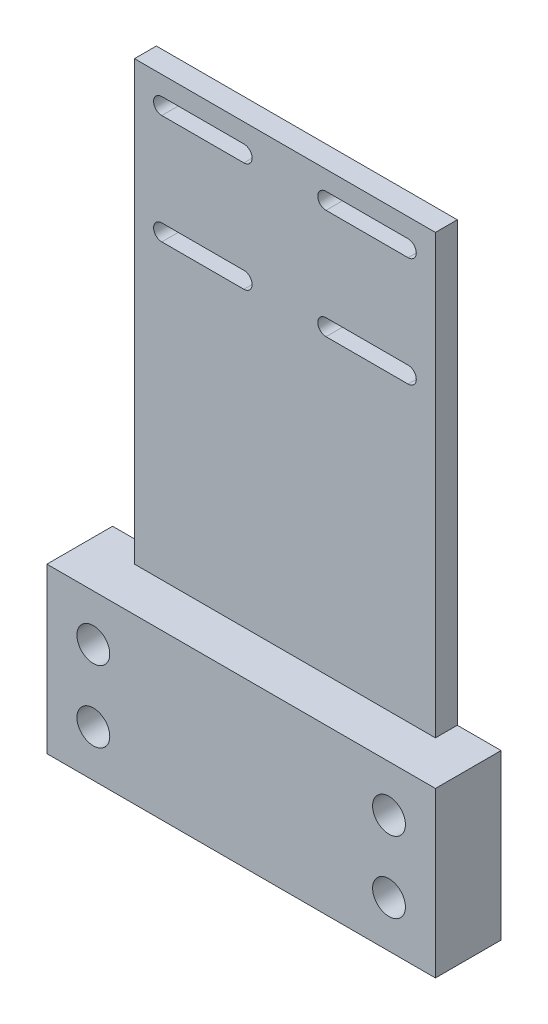
from build123d import *

# Parameters (mm, degrees)
SKETCH1_W           = 55
SKETCH1_H           = 30
BOSS_EXTRUDE1_DEPTH = 4
SKETCH4_W           = 55
SKETCH4_H           = 4
BOSS_EXTRUDE2_DEPTH = 80
SKETCH5_W           = 4
SKETCH5_H           = 30
BOSS_EXTRUDE3_DEPTH = 8
SKETCH6_W           = 4
SKETCH6_H           = 30
BOSS_EXTRUDE4_DEPTH = 8
SKETCH7_W           = 71
SKETCH7_H           = 30
BOSS_EXTRUDE5_DEPTH = 8
SKETCH9_R           = 3
CUT_EXTRUDE1_DEPTH  = 8
SKETCH8_R           = 5
CUT_EXTRUDE4_DEPTH  = 4


with BuildPart() as part:
    # Sketch1 → Boss-Extrude1 (new body)
    with BuildSketch(Plane.XY):
        with Locations((0, 20)):
            Rectangle(SKETCH1_W, SKETCH1_H)
        with BuildLine():
            Line((22.5, 31.5), (7.5, 31.5))
            ThreePointArc((7.5, 31.5), (6, 30), (7.5, 28.5))
            Line((7.5, 28.5), (22.5, 28.5))
            ThreePointArc((22.5, 28.5), (24, 30), (22.5, 31.5))
        make_face(mode=Mode.SUBTRACT)
        with BuildLine():
            Line((22.5, 8.5), (7.5, 8.5))
            ThreePointArc((7.5, 8.5), (6, 10), (7.5, 11.5))
            Line((7.5, 11.5), (22.5, 11.5))
            ThreePointArc((22.5, 11.5), (24, 10), (22.5, 8.5))
        make_face(mode=Mode.SUBTRACT)
        with BuildLine():
            Line((-22.5, 8.5), (-7.5, 8.5))
            ThreePointArc((-7.5, 8.5), (-6, 10), (-7.5, 11.5))
            Line((-7.5, 11.5), (-22.5, 11.5))
            ThreePointArc((-22.5, 11.5), (-24, 10), (-22.5, 8.5))
        make_face(mode=Mode.SUBTRACT)
        with BuildLine():
            Line((-7.5, 28.5), (-22.5, 28.5))
            ThreePointArc((-22.5, 28.5), (-24, 30), (-22.5, 31.5))
            Line((-22.5, 31.5), (-7.5, 31.5))
            ThreePointArc((-7.5, 31.5), (-6, 30), (-7.5, 28.5))
        make_face(mode=Mode.SUBTRACT)
    extrude(amount=BOSS_EXTRUDE1_DEPTH)

    # Sketch4 → Boss-Extrude2 (add)
    with BuildSketch(Plane.XZ.offset(-5)):
        with Locations((0, 2)):
            Rectangle(SKETCH4_W, SKETCH4_H)
    extrude(amount=BOSS_EXTRUDE2_DEPTH)

    # Sketch5 → Boss-Extrude3 (add)
    with BuildSketch(Plane.ZY.offset(27.5)):
        with Locations((2, -60)):
            Rectangle(SKETCH5_W, SKETCH5_H)
    extrude(amount=BOSS_EXTRUDE3_DEPTH)

    # Sketch6 → Boss-Extrude4 (add)
    with BuildSketch(Plane(origin=(27.5, 0, 0), x_dir=(0, 0, -1), z_dir=(1, 0, 0))):
        with Locations((-2, -60)):
            Rectangle(SKETCH6_W, SKETCH6_H)
    extrude(amount=BOSS_EXTRUDE4_DEPTH)

    # Sketch7 → Boss-Extrude5 (add)
    with BuildSketch(Plane.XY.offset(4)):
        with Locations((0, -60)):
            Rectangle(SKETCH7_W, SKETCH7_H)
    extrude(amount=BOSS_EXTRUDE5_DEPTH)

    # Sketch9 → Cut-Extrude1 (cut)
    with BuildSketch(Plane.XY.offset(12)):
        with Locations((27.014718626, -66.514718626)):
            Circle(SKETCH9_R)
        with Locations((27.014718626, -53.485281374)):
            Circle(SKETCH9_R)
        with Locations((-27.014718626, -53.485281374)):
            Circle(SKETCH9_R)
        with Locations((-27.014718626, -66.514718626)):
            Circle(SKETCH9_R)
    extrude(amount=-CUT_EXTRUDE1_DEPTH, mode=Mode.SUBTRACT)

    # Sketch8 → Cut-Extrude4 (cut)
    with BuildSketch(Plane(origin=(0, 0, 0), x_dir=(-1, 0, 0), z_dir=(0, 0, -1))):
        with Locations((-27.014718626, -53.485281374)):
            Circle(SKETCH8_R)
        with Locations((-27.014718626, -66.514718626)):
            Circle(SKETCH8_R)
        with Locations((27.014718626, -53.485281374)):
            Circle(SKETCH8_R)
        with Locations((27.014718626, -66.514718626)):
            Circle(SKETCH8_R)
    extrude(amount=-CUT_EXTRUDE4_DEPTH, mode=Mode.SUBTRACT)


solid = part.part
